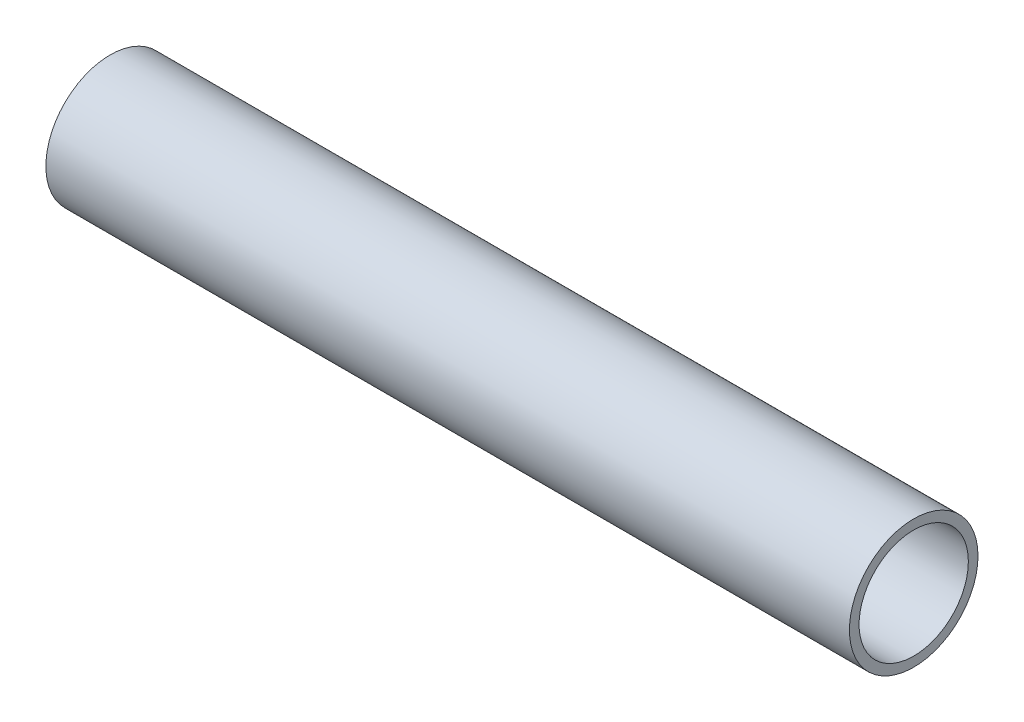
from build123d import *

# Parameters (mm, degrees)
SKETCH1_R           = 2
SKETCH1_R_2         = 1.7
BOSS_EXTRUDE2_DEPTH = 12.5


with BuildPart() as part:
    # Sketch1 → Boss-Extrude2 (new, symmetric)
    with BuildSketch(Plane(origin=(0, 0, 0), x_dir=(0, 0, -1), z_dir=(1, 0, 0))):
        Circle(SKETCH1_R)
        Circle(SKETCH1_R_2, mode=Mode.SUBTRACT)
    extrude(amount=BOSS_EXTRUDE2_DEPTH, both=True)


solid = part.part
